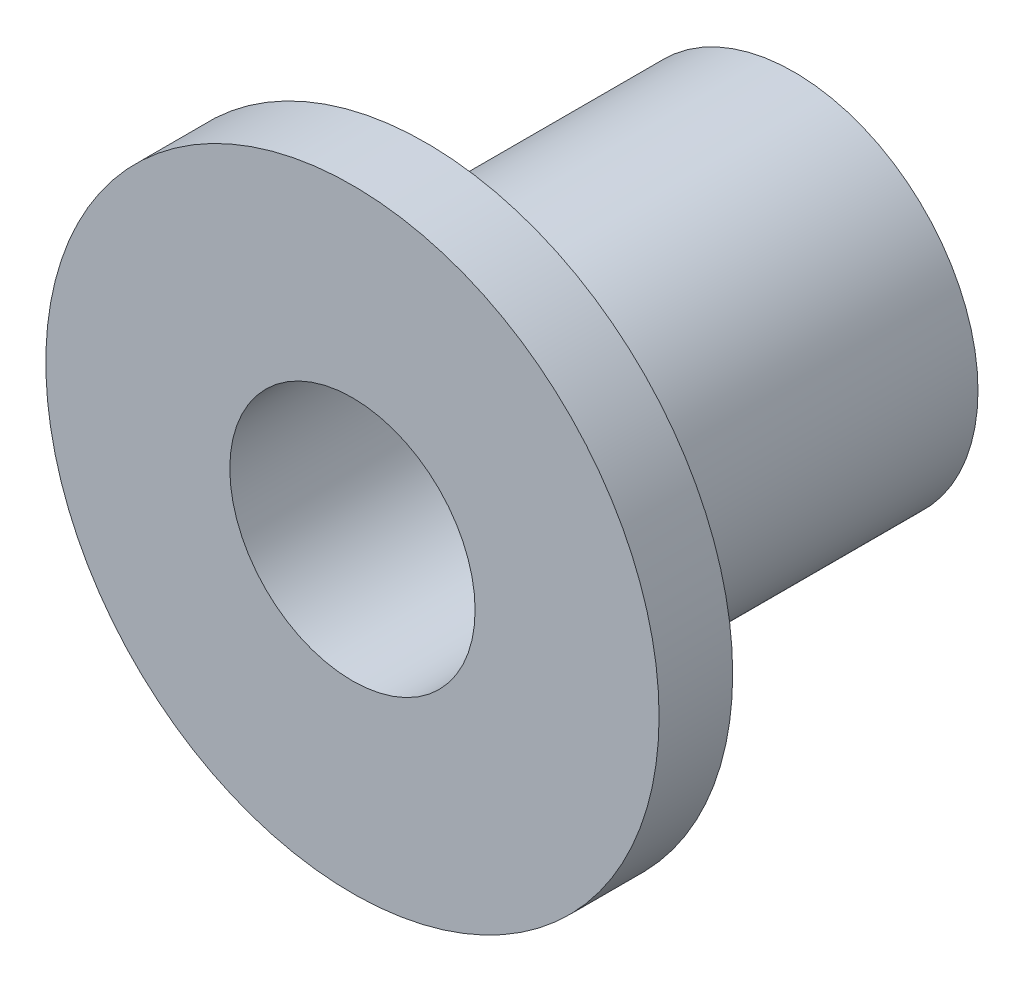
from build123d import *

# Parameters (mm, degrees)
SKETCH1_R           = 12.5
SKETCH1_R_2         = 5
BOSS_EXTRUDE1_DEPTH = 3
BOSS_EXTRUDE2_START = -15
SKETCH1_3_R         = 7.5
SKETCH1_3_R_2       = 5
BOSS_EXTRUDE2_DEPTH = 15


with BuildPart() as part:
    # Sketch1 → Boss-Extrude1 (new body)
    with BuildSketch(Plane.XY):
        Circle(SKETCH1_R)
        Circle(SKETCH1_R_2, mode=Mode.SUBTRACT)
    extrude(amount=BOSS_EXTRUDE1_DEPTH)

    # Sketch1<3> → Boss-Extrude2 (add)
    with BuildSketch(Plane.XY.offset(BOSS_EXTRUDE2_START)):
        Circle(SKETCH1_3_R)
        Circle(SKETCH1_3_R_2, mode=Mode.SUBTRACT)
    extrude(amount=BOSS_EXTRUDE2_DEPTH)


solid = part.part
